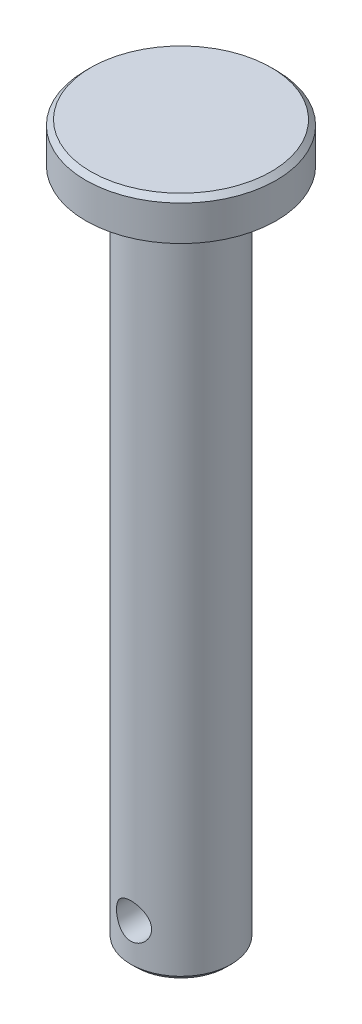
from build123d import *

# Parameters (mm, degrees)
CORTE_EXTRUS_O1_DEPTH      = 76.914425507
CORTE_EXTRUS_O1_DEPTH_BACK = 76.914425507
ESBO_O2_R                  = 3.5


with BuildPart() as part:
    # Esboço1 → Revolução1 (revolve)
    with BuildSketch(Plane(origin=(0, 0, 0), x_dir=(0, 0, -1), z_dir=(1, 0, 0)), mode=Mode.PRIVATE) as revolu_o1_sk:
        Polygon((0, 71), (18, 71), (19, 70), (19, 63), (10, 63), (10, -70), (9, -71), (0, -71), align=None)
    revolve(revolu_o1_sk.sketch.rotate(Axis((0, 71, 0), (0, -1, 0)), 180), axis=Axis((0, 71, 0), (0, -1, 0)))

    # Esboço2 → Corte-extrusão1 (cut, two sides: drawn at the far end of the back side and taken through both)
    with BuildSketch(Plane.XY.offset(-CORTE_EXTRUS_O1_DEPTH_BACK)):
        with Locations((0, -62.5)):
            Circle(ESBO_O2_R)
    extrude(amount=CORTE_EXTRUS_O1_DEPTH + CORTE_EXTRUS_O1_DEPTH_BACK, mode=Mode.SUBTRACT)


solid = part.part
